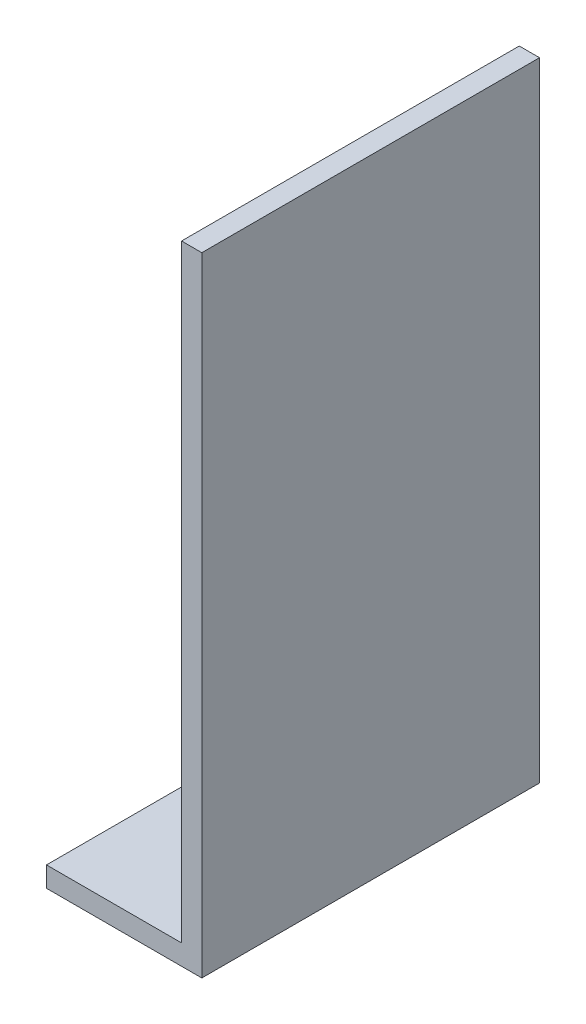
from build123d import *

# Parameters (mm, degrees)
SKETCH1_W      = 23
SKETCH1_H      = 50
EXTRUDE1_DEPTH = 3
SKETCH2_W      = 3
SKETCH2_H      = 50
EXTRUDE2_DEPTH = 90


with BuildPart() as part:
    # Sketch1 → Extrude1 (new body)
    with BuildSketch(Plane(origin=(0, 0, 0), x_dir=(1, 0, 0), z_dir=(0, 1, 0))):
        with Locations((11.5, 25)):
            Rectangle(SKETCH1_W, SKETCH1_H)
    extrude(amount=EXTRUDE1_DEPTH)

    # Sketch2 → Extrude2 (add)
    with BuildSketch(Plane(origin=(0, 3, 0), x_dir=(1, 0, 0), z_dir=(0, 1, 0))):
        with Locations((21.5, 25)):
            Rectangle(SKETCH2_W, SKETCH2_H)
    extrude(amount=EXTRUDE2_DEPTH)


solid = part.part
